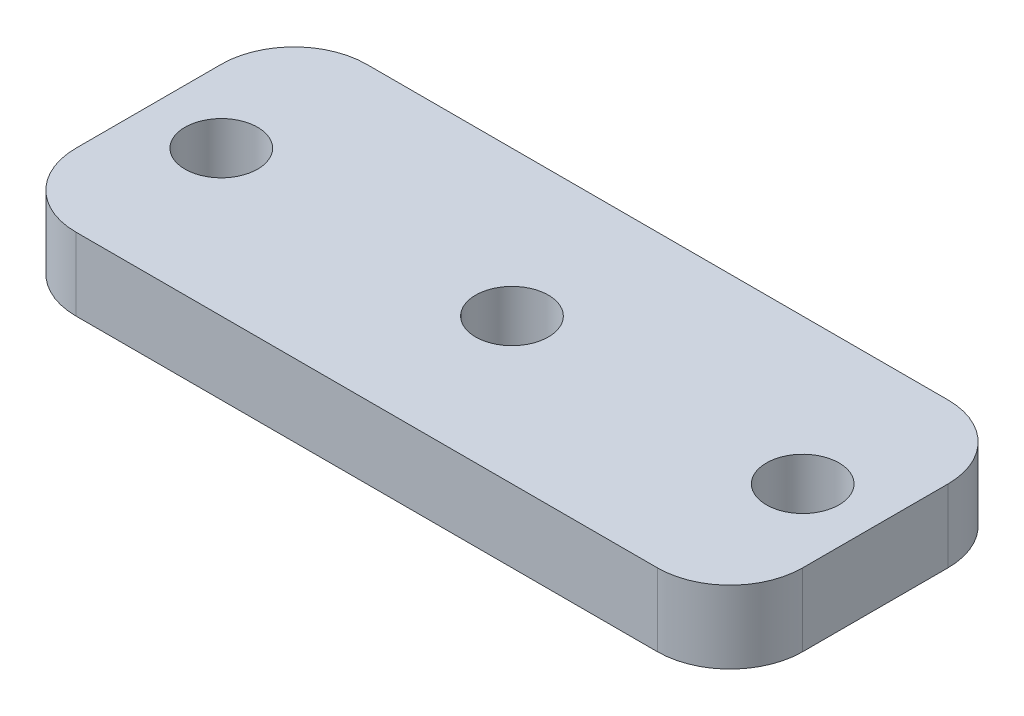
from build123d import *

# Parameters (mm, degrees)
SKETCH1_W           = 63.5
SKETCH1_H           = 25.4
SKETCH1_R           = 3.175
BOSS_EXTRUDE1_DEPTH = 6.35
FILLET1_R           = 6.35


with BuildPart() as part:
    # Sketch1 → Boss-Extrude1 (new body)
    with BuildSketch(Plane(origin=(0, 0, 0), x_dir=(1, 0, 0), z_dir=(0, 1, 0))):
        with Locations((31.75, 12.7)):
            Rectangle(SKETCH1_W, SKETCH1_H)
        with Locations(Location((6.35, 12.7, 0), (0, 0, 270))):
            Circle(SKETCH1_R, mode=Mode.SUBTRACT)
        with Locations(Location((31.75, 12.7, 0), (0, 0, 270))):
            Circle(SKETCH1_R, mode=Mode.SUBTRACT)
        with Locations(Location((57.15, 12.7, 0), (0, 0, 90))):
            Circle(SKETCH1_R, mode=Mode.SUBTRACT)
    extrude(amount=BOSS_EXTRUDE1_DEPTH)

    # Fillet1
    fillet1_edges = [part.edges().sort_by_distance(p)[0] for p in [
        (0, 3.175, -25.4),
        (63.5, 3.175, -25.4),
        (63.5, 3.175, 0),
        (0, 3.175, 0),
    ]]
    fillet(fillet1_edges, radius=FILLET1_R)


solid = part.part
